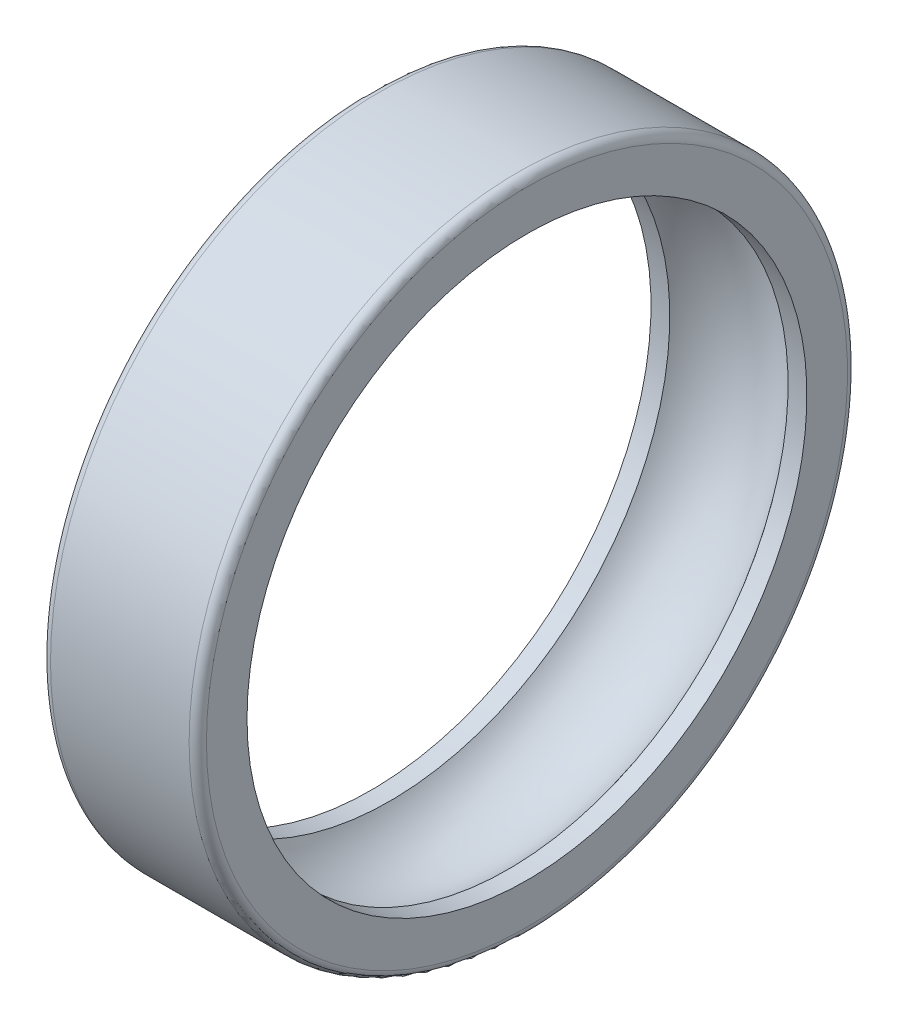
from build123d import *

# Parameters (mm, degrees)
FILLET1_R = 2.5


with BuildPart() as part:
    # Sketch2 → Revolve1 (revolve)
    with BuildSketch(Plane.XY, mode=Mode.PRIVATE) as revolve1_sk:
        with BuildLine():
            Line((22.5, 80.79), (17.068172134, 80.79))
            ThreePointArc((17.068172134, 80.79), (0, 89.74), (-17.068172134, 80.79))
            Line((-17.068172134, 80.79), (-22.5, 80.79))
            Line((-22.5, 80.79), (-22.5, 95))
            Line((-22.5, 95), (22.5, 95))
            Line((22.5, 95), (22.5, 80.79))
        make_face()
    revolve(revolve1_sk.sketch.rotate(Axis((-12.993521412, 0, 0), (1, 0, 0)), 90), axis=Axis((-12.993521412, 0, 0), (1, 0, 0)))

    # Fillet1
    fillet1_edges = [part.edges().sort_by_distance(p)[0] for p in [
        (22.5, 0, -95),
        (-22.5, 0, -95),
    ]]
    fillet(fillet1_edges, radius=FILLET1_R)


solid = part.part
